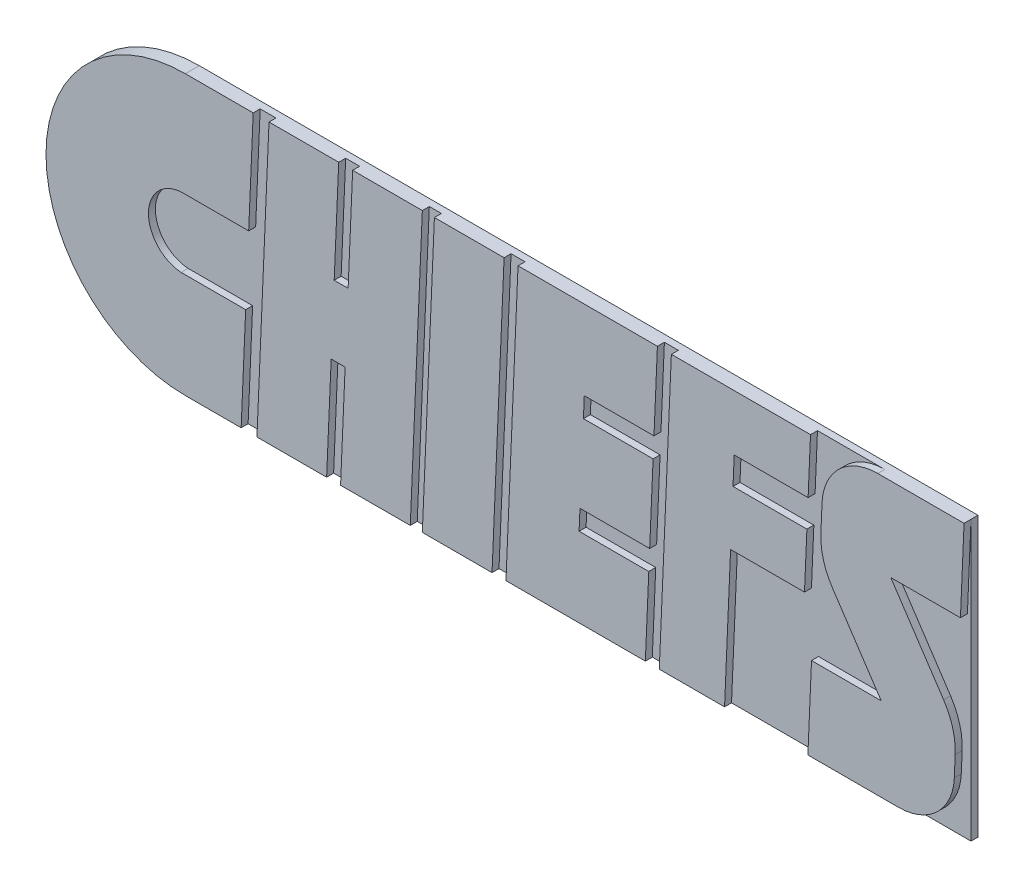
from build123d import *

# Parameters (mm, degrees)
EXTRUDE2_DEPTH = 1.27
EXTRUDE3_DEPTH = 1.27
EXTRUDE4_DEPTH = 1.27


with BuildPart() as part:
    # Sketch2 → Extrude2 (new body)
    with BuildSketch(Plane.XY):
        with BuildLine():
            Line((25.4, 0), (167.299096948, 0))
            Line((167.299096948, 0), (167.299096948, 50.8))
            Line((167.299096948, 50.8), (25.4, 50.8))
            ThreePointArc((25.4, 50.8), (0, 25.4), (25.4, 0))
        make_face()
    extrude(amount=EXTRUDE2_DEPTH)

    # Sketch5 → Extrude3 (add)
    with BuildSketch(Plane.XY.offset(1.27)):
        with BuildLine():
            Line((25.4, 50.8), (37.759096935, 50.8))
            Line((37.759096935, 50.8), (36.934864936, 31.759918178))
            Line((36.934864936, 31.759918178), (25.187364936, 31.759918178))
            ThreePointArc((25.187364936, 31.759918178), (18.674313706, 25.683931539), (24.624718961, 19.055950907))
            Line((24.624718961, 19.055950907), (36.384918961, 19.055950907))
            Line((36.384918961, 19.055950907), (35.56, 0))
            Line((35.56, 0), (25.4, 0))
            ThreePointArc((25.4, 0), (0, 25.4), (25.4, 50.8))
        make_face()
    extrude(amount=EXTRUDE3_DEPTH)

    # Sketch5<4> → Extrude4 (add)
    with BuildSketch(Plane.XY.offset(1.27)):
        Polygon((53.34, 50.8), (40.64, 50.8), (38.440216103, -0.015869084), (51.140216103, -0.015869084), (51.965822026, 19.055950907), (54.505822026, 19.055950907), (53.680316159, -0.013557756), (66.380816438, -0.002001116), (68.58, 50.8), (55.88, 50.8), (55.055768, 31.759918178), (52.515768, 31.759918178), align=None)
        Polygon((83.479096935, 50.8), (70.779096935, 50.8), (68.58, 0), (81.28, 0), align=None)
        Polygon((111.419096935, 50.8), (86.019096935, 50.8), (83.82, 0), (109.22, 0), (109.846156204, 14.464453409), (97.146156204, 14.464453409), (97.306540074, 18.16938358), (110.006540074, 18.16938358), (110.632696278, 32.633836988), (97.932696278, 32.633836988), (98.093080148, 36.33876716), (110.793080148, 36.33876716), align=None)
        Polygon((139.318340653, 50.8), (113.959096935, 50.8), (111.76, 0), (123.65404294, 0), (124.753591407, 25.4), (138.218792185, 25.4), (138.658714454, 35.562376595), (125.193513676, 35.562376595), (125.413217607, 40.637623405), (138.878418385, 40.637623405), align=None)
        with BuildLine():
            Line((167.299096935, 50.8), (151.568912005, 50.8))
            ThreePointArc((151.568912005, 50.8), (144.541778303, 47.977914686), (141.418418385, 41.079407862))
            Line((141.418418385, 41.079407862), (141.206176472, 36.176536601))
            ThreePointArc((141.206176472, 36.176536601), (141.660521084, 32.217758839), (143.31923128, 28.594634375))
            Line((143.31923128, 28.594634375), (152.200348571, 15.24))
            Line((152.200348571, 15.24), (139.500348571, 15.24))
            Line((139.500348571, 15.24), (138.840285624, 0))
            Line((138.840285624, 0), (155.369404166, 0))
            ThreePointArc((155.369404166, 0), (162.396457641, 2.822008486), (165.519888176, 9.720370185))
            Line((165.519888176, 9.720370185), (165.683377481, 13.495126865))
            ThreePointArc((165.683377481, 13.495126865), (165.229082159, 17.454048315), (163.570334687, 21.077306532))
            Line((163.570334687, 21.077306532), (153.939033989, 35.56))
            Line((153.939033989, 35.56), (166.639033989, 35.56))
            Line((166.639033989, 35.56), (167.299096935, 50.8))
        make_face()
    extrude(amount=EXTRUDE4_DEPTH)


solid = part.part
